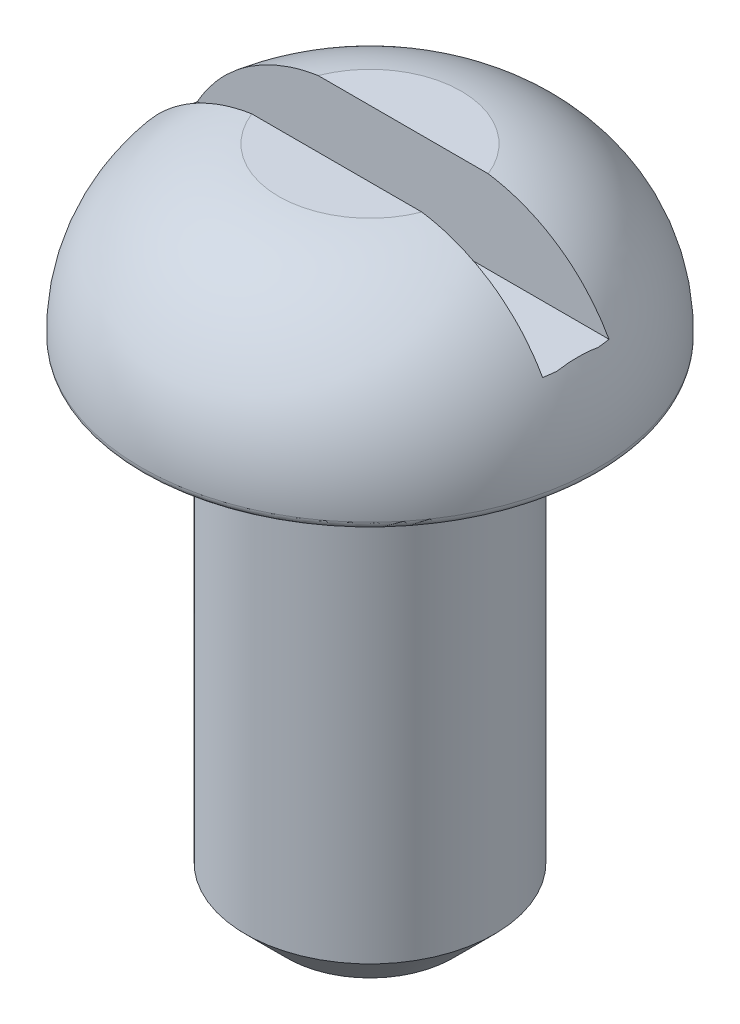
from build123d import *

# Parameters (mm, degrees)
FILLET_1_R          = 0.1
SKETCH_3_W          = 5
SKETCH_3_H          = 0.8
CUT_EXTRUDE_2_DEPTH = 1


with BuildPart() as part:
    # Эскиз1 → Повернуть1 (revolve)
    with BuildSketch(Plane.XY):
        with BuildLine():
            Line((2.75, 5.9), (1.5, 5.9))
            Line((1.5, 5.9), (1.5, 0.5))
            Line((1.5, 0.5), (1, 0))
            Line((1, 0), (0, 0))
            Line((0, 0), (0, 8))
            Line((0, 8), (1.1, 8))
            ThreePointArc((1.1, 8), (2.333466256, 7.270937772), (2.75, 5.9))
        make_face()
    revolve(axis=Axis((0, 0, 0), (0, 1, 0)))

    # Скругление1
    fillet_1_edges = [part.edges().sort_by_distance(p)[0] for p in [
        (-2.75, 5.9, 0),
    ]]
    fillet(fillet_1_edges, radius=FILLET_1_R)

    # Эскиз3 → Вырез-Вытянуть2 (cut)
    with BuildSketch(Plane(origin=(0, 8, 0), x_dir=(-1, 0, 0), z_dir=(0, 1, 0))):
        Rectangle(SKETCH_3_W, SKETCH_3_H)
    extrude(amount=-CUT_EXTRUDE_2_DEPTH, mode=Mode.SUBTRACT)


solid = part.part
